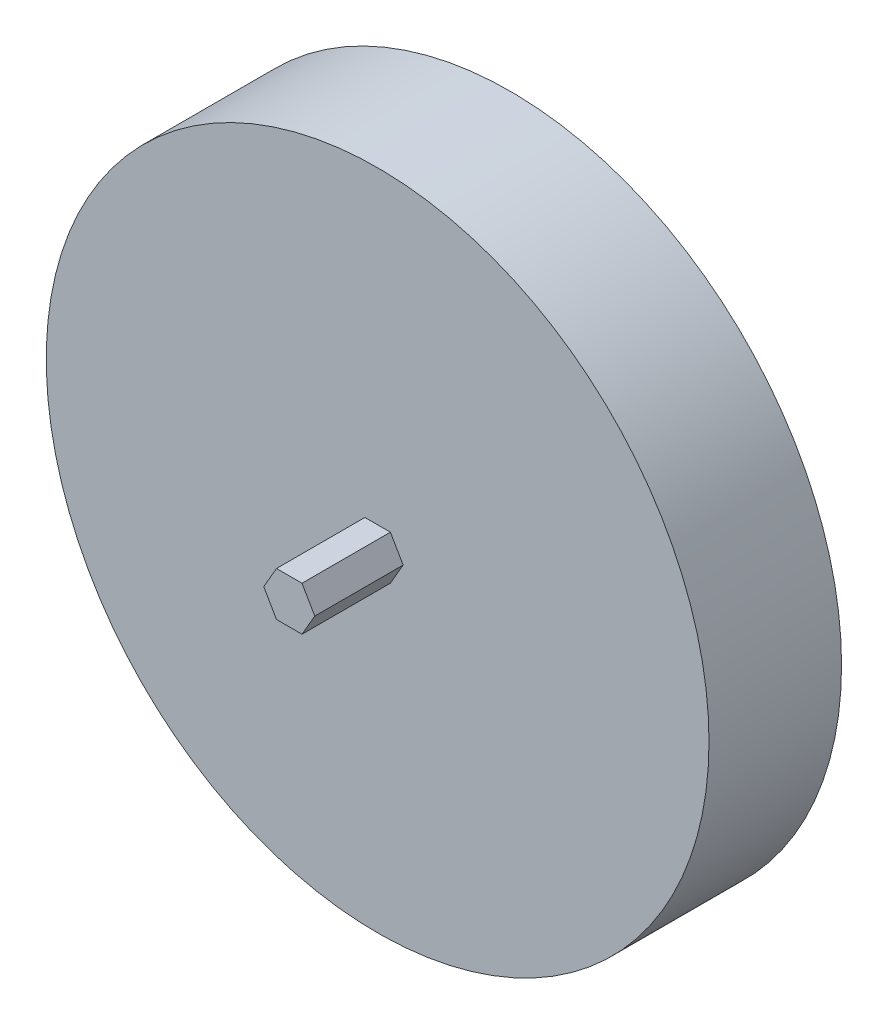
from build123d import *

# Parameters (mm, degrees)
SKETCH1_R           = 15
BOSS_EXTRUDE1_DEPTH = 6
BOSS_EXTRUDE2_DEPTH = 4


with BuildPart() as part:
    # Sketch1 → Boss-Extrude1 (new body)
    with BuildSketch(Plane.XY):
        Circle(SKETCH1_R)
    extrude(amount=BOSS_EXTRUDE1_DEPTH)

    # Sketch4 → Boss-Extrude2 (add)
    with BuildSketch(Plane.XY.offset(6)):
        Polygon((1.154700538, 0), (0.577350269, 1), (-0.577350269, 1), (-1.154700538, 0), (-0.577350269, -1), (0.577350269, -1), align=None)
    extrude(amount=BOSS_EXTRUDE2_DEPTH)


solid = part.part
